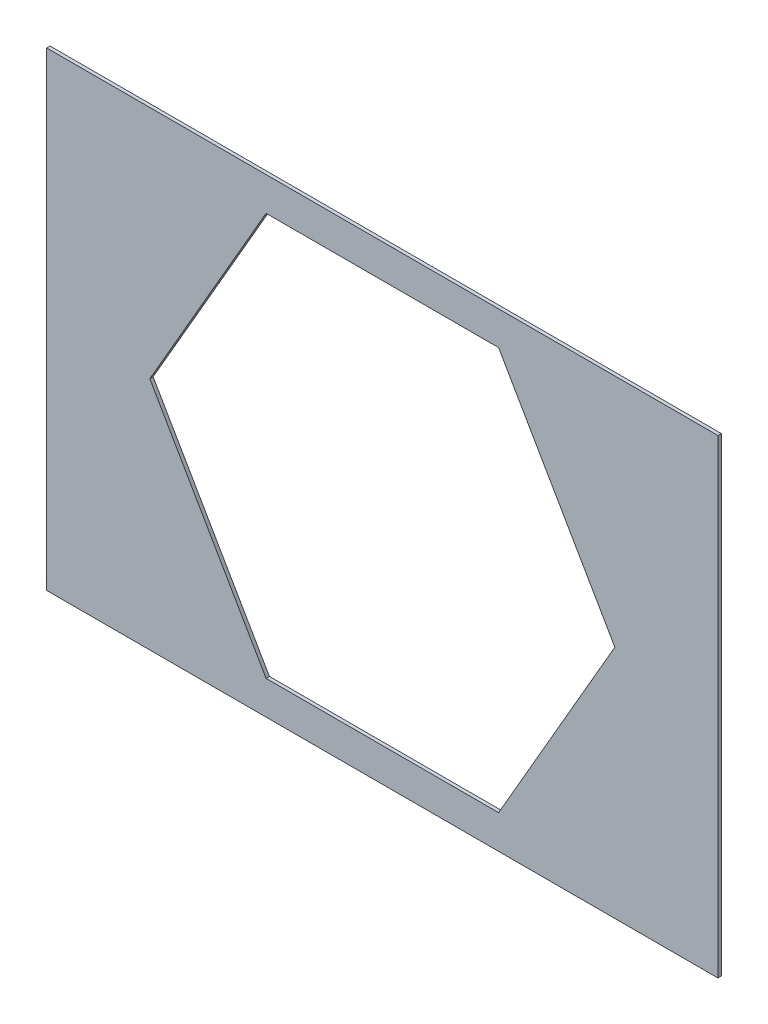
from build123d import *

# Parameters (mm, degrees)
SKETCH1_W           = 1270
SKETCH1_H           = 889
BOSS_EXTRUDE1_DEPTH = 6.35


with BuildPart() as part:
    # Sketch1 → Boss-Extrude1 (new body)
    with BuildSketch(Plane.XY):
        Rectangle(SKETCH1_W, SKETCH1_H)
        Polygon((-439.940905122, 0), (-219.970452561, -381), (219.970452561, -381), (439.940905122, 0), (219.970452561, 381), (-219.970452561, 381), align=None, mode=Mode.SUBTRACT)
    extrude(amount=BOSS_EXTRUDE1_DEPTH)


solid = part.part
